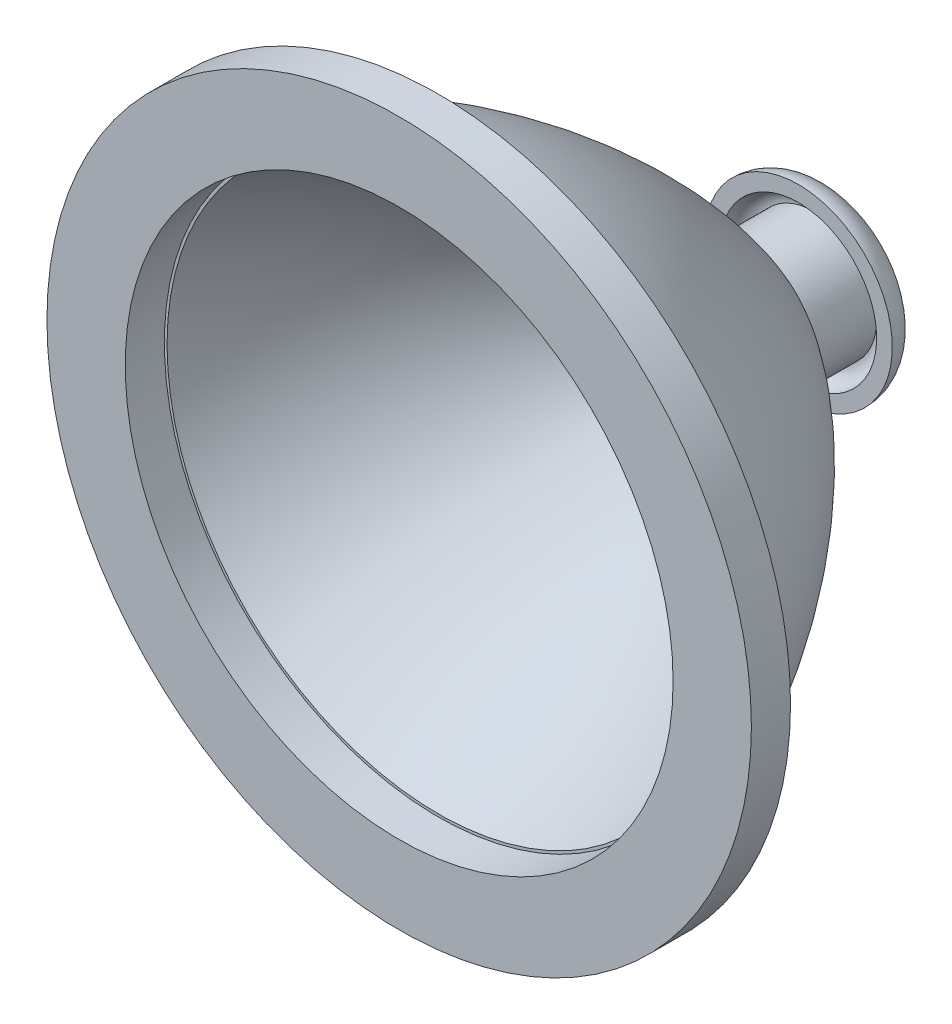
from build123d import *

# Parameters (mm, degrees)
LENS_SHELL_T          = -6.35
SKETCH2_R             = 10.16
LENS_NECK_DEPTH       = 10.16
BULB_HOLE_D           = 13.49248
BULB_HOLE_CBORE_D     = 15.24
BULB_HOLE_CBORE_DEPTH = 5.08
SKETCH5_R             = 57.15
SKETCH5_R_2           = 44.45
LENS_COVER_DEPTH      = 6.35


with BuildPart() as part:
    # Sketch1 → Base Revolve (revolve)
    with BuildSketch(Plane(origin=(0, 0, 0), x_dir=(0, 0, -1), z_dir=(1, 0, 0)), mode=Mode.PRIVATE) as base_revolve_sk:
        with BuildLine():
            Line((0, 0), (0, 50.8))
            ThreePointArc((0, 50.8), (28.740706548, 34.655883185), (50.8, 10.16))
            Line((50.8, 10.16), (50.8, 0))
            Line((50.8, 0), (0, 0))
        make_face()
    revolve(base_revolve_sk.sketch.rotate(Axis((0, 0, 22.428775877), (0, 0, -1)), 90), axis=Axis((0, 0, 22.428775877), (0, 0, -1)))

    # Lens Shell
    lens_shell_openings = [part.faces().sort_by_distance(p)[0] for p in [
        (0, 0, 0),
    ]]
    offset(amount=LENS_SHELL_T, openings=lens_shell_openings, kind=Kind.INTERSECTION)

    # Sketch2 → Lens Neck (add)
    with BuildSketch(Plane(origin=(0, 0, -50.8), x_dir=(-1, 0, 0), z_dir=(0, 0, -1))):
        Circle(SKETCH2_R)
    extrude(amount=LENS_NECK_DEPTH)

    # Bulb Hole (through all)
    with Locations(Plane(origin=(0.152613178, 0.03794408, -44.45), x_dir=(1, 0, 0), z_dir=(0, 0, 1))):
        with Locations((0, 0)):
            CounterBoreHole(BULB_HOLE_D / 2, BULB_HOLE_CBORE_D / 2, BULB_HOLE_CBORE_DEPTH)

    # Sketch5 → Lens Cover (add)
    with BuildSketch(Plane.XY):
        Circle(SKETCH5_R)
        Circle(SKETCH5_R_2, mode=Mode.SUBTRACT)
    extrude(amount=LENS_COVER_DEPTH)


with BuildPart() as body_2:
    # Sketch4 → Revolve-Thin1 (revolve)
    with BuildSketch(Plane(origin=(0, 0, 0), x_dir=(0, 0, -1), z_dir=(1, 0, 0)), mode=Mode.PRIVATE) as revolve_thin1_sk:
        with BuildLine():
            ThreePointArc((60.96, 10.16), (60.216051224, 11.956051224), (58.42, 12.7))
            Line((58.42, 12.7), (58.42, 15.24))
            ThreePointArc((58.42, 15.24), (62.012102448, 13.752102448), (63.5, 10.16))
            Line((63.5, 10.16), (60.96, 10.16))
        make_face()
    revolve(revolve_thin1_sk.sketch.rotate(Axis((0, 0, -60.96), (0, 0, 1)), 90), axis=Axis((0, 0, -60.96), (0, 0, 1)))


solid = Compound([part.part, body_2.part])
